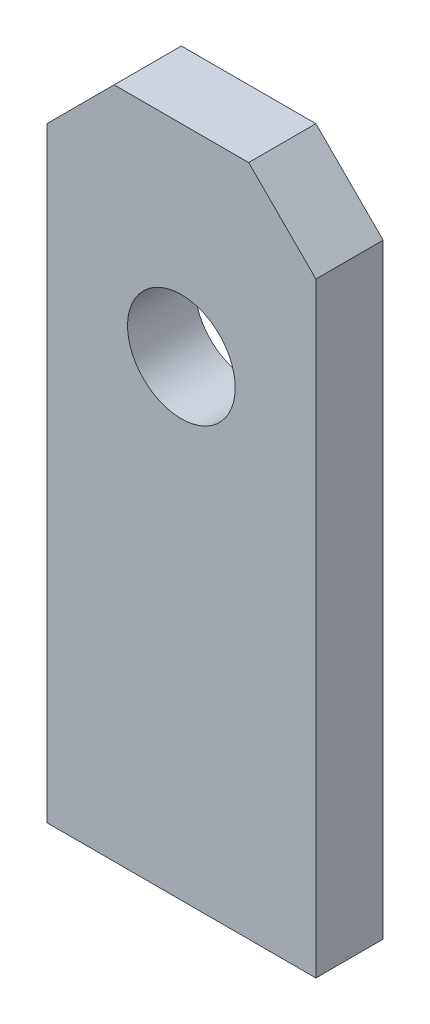
from build123d import *

# Parameters (mm, degrees)
SKETCH1_R           = 8
BOSS_EXTRUDE1_DEPTH = 5


with BuildPart() as part:
    # Sketch1 → Boss-Extrude1 (new, symmetric)
    with BuildSketch(Plane.XY):
        Polygon((-20, -50), (20, -50), (20, 40), (10, 50), (-10, 50), (-20, 40), align=None)
        with Locations((0, 20)):
            Circle(SKETCH1_R, mode=Mode.SUBTRACT)
    extrude(amount=BOSS_EXTRUDE1_DEPTH, both=True)


solid = part.part
